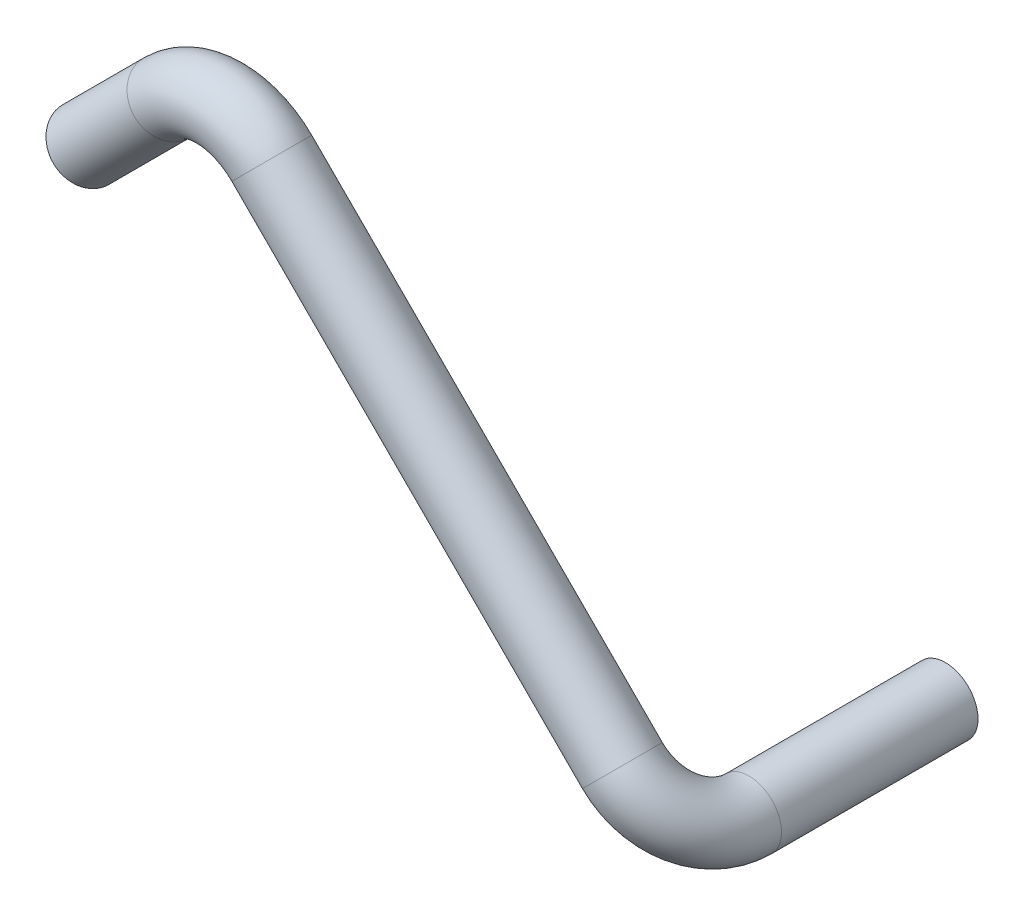
from build123d import *

# Parameters (mm, degrees)
PIPESKETCH_R    = 16.764
PIPESKETCH_R_2  = 13.3858
EXTRUSION_DEPTH = 95
SKETCH_3_R      = 16.764
SKETCH_3_R_2    = 13.3858
EXTRUDE_2_DEPTH = 5.980008255
SKETCH_4_R      = 16.764
SKETCH_4_R_2    = 13.3858
REVOLVE_2_ANGLE = 90
SKETCH_5_R      = 16.764
SKETCH_5_R_2    = 13.3858
EXTRUDE_3_DEPTH = 254.900237781
SKETCH_6_R      = 16.764
SKETCH_6_R_2    = 13.3858
REVOLVE_3_ANGLE = 90
SKETCH_7_R      = 16.764
SKETCH_7_R_2    = 13.3858
EXTRUDE_4_DEPTH = 58.9


with BuildPart() as part:
    # PipeSketch → Extrusion (new body)
    with BuildSketch(Plane.XY):
        Circle(PIPESKETCH_R)
        Circle(PIPESKETCH_R_2, mode=Mode.SUBTRACT)
    extrude(amount=EXTRUSION_DEPTH)

    # 草图3 → 凸台-拉伸2 (add)
    with BuildSketch(Plane.XY.offset(95)):
        Circle(SKETCH_3_R)
        Circle(SKETCH_3_R_2, mode=Mode.SUBTRACT)
    extrude(amount=EXTRUDE_2_DEPTH)

    # 草图4 → 旋转2 (revolve)
    with BuildSketch(Plane.XY.offset(100.980008255)):
        with Locations(Location((0, 0, 0), (0, 0, 315))):
            Circle(SKETCH_4_R)
        with Locations(Location((0, 0, 0), (0, 0, 315))):
            Circle(SKETCH_4_R_2, mode=Mode.SUBTRACT)
    revolve(axis=Axis((-26.940768363, 26.940768363, 100.980008255), (-0.7071067811865476, -0.7071067811865476, 0)), revolution_arc=REVOLVE_2_ANGLE)

    # 草图5 → 凸台-拉伸3 (add)
    with BuildSketch(Plane(origin=(-26.940768363, 26.940768363, 0), x_dir=(0.7071067811865475, 0.7071067811865477, 0), z_dir=(-0.7071067811865477, 0.7071067811865475, 0))):
        with Locations(Location((0, -139.080008255, 0), (0, 0, 270))):
            Circle(SKETCH_5_R)
        with Locations(Location((0, -139.080008255, 0), (0, 0, 270))):
            Circle(SKETCH_5_R_2, mode=Mode.SUBTRACT)
    extrude(amount=EXTRUDE_3_DEPTH)

    # 草图6 → 旋转3 (revolve)
    with BuildSketch(Plane(origin=(-207.182455024, 207.182455024, 0), x_dir=(0, 0, 1), z_dir=(-0.7071067811865476, 0.7071067811865476, 0))):
        with Locations(Location((139.080008255, 0, 0), (0, 0, 90))):
            Circle(SKETCH_6_R)
        with Locations(Location((139.080008255, 0, 0), (0, 0, 90))):
            Circle(SKETCH_6_R_2, mode=Mode.SUBTRACT)
    revolve(axis=Axis((-234.123223388, 180.241686661, 139.080008255), (0, 0, 1)), revolution_arc=REVOLVE_3_ANGLE)

    # 草图7 → 凸台-拉伸4 (add)
    with BuildSketch(Plane(origin=(-26.940768363, -26.940768363, 0), x_dir=(-0.7071067811865479, 0.7071067811865472, 0), z_dir=(-0.7071067811865472, -0.7071067811865479, 0))):
        with Locations((331.100237781, -139.080008255)):
            Circle(SKETCH_7_R)
        with Locations((331.100237781, -139.080008255)):
            Circle(SKETCH_7_R_2, mode=Mode.SUBTRACT)
    extrude(amount=EXTRUDE_4_DEPTH)


solid = part.part
